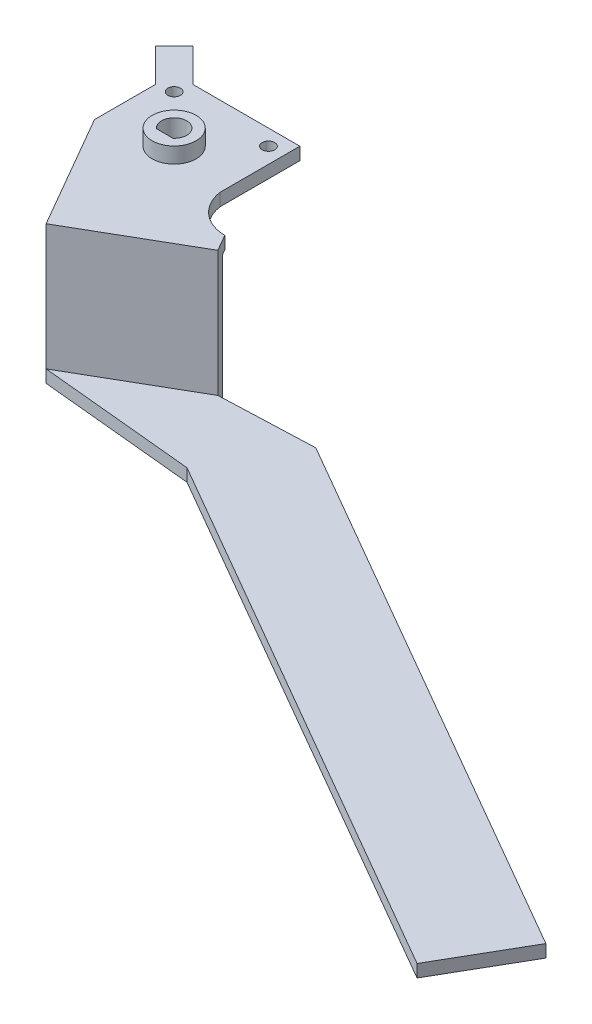
from build123d import *

# Parameters (mm, degrees)
SKETCH1_R           = 2
BOSS_EXTRUDE1_DEPTH = 4
SKETCH2_R           = 7
BOSS_EXTRUDE2_DEPTH = 5
BOSS_EXTRUDE6_DEPTH = 40
BOSS_EXTRUDE7_DEPTH = 4
SKETCH9_W           = 30
SKETCH9_H           = 4
BOSS_EXTRUDE8_DEPTH = 200


with BuildPart() as part:
    # Sketch1 → Boss-Extrude1 (new body)
    with BuildSketch(Plane(origin=(0, 0, 0), x_dir=(1, 0, 0), z_dir=(0, 1, 0))):
        with BuildLine():
            Line((1, -41.732050808), (35.641016151, -21.732050808))
            Line((35.641016151, -21.732050808), (32.641016151, -16.535898385))
            ThreePointArc((32.641016151, -16.535898385), (24.260749779, -13.277014078), (20, -5.358983849))
            Line((20, -5.358983849), (20, 20))
            Line((20, 20), (-14, 20))
            Line((-14, 20), (-24.606601718, 30.606601718))
            Line((-24.606601718, 30.606601718), (-30.606601718, 24.606601718))
            Line((-30.606601718, 24.606601718), (-20, 14))
            Line((-20, 14), (-20, -5.358983849))
            Line((-20, -5.358983849), (1, -41.732050808))
        make_face()
        with Locations(Location((-15, 15, 0), (0, 0, 270))):
            Circle(SKETCH1_R, mode=Mode.SUBTRACT)
        with Locations(Location((15, 15, 0), (0, 0, 270))):
            Circle(SKETCH1_R, mode=Mode.SUBTRACT)
        with BuildLine():
            Line((-2.645751311, -3), (2.645751311, -3))
            ThreePointArc((2.645751311, -3), (0, 4), (-2.645751311, -3))
        make_face(mode=Mode.SUBTRACT)
    extrude(amount=BOSS_EXTRUDE1_DEPTH)

    # Sketch2 → Boss-Extrude2 (add)
    with BuildSketch(Plane(origin=(0, 4, 0), x_dir=(1, 0, 0), z_dir=(0, 1, 0))):
        with Locations(Location((0, 0, 0), (0, 0, 270))):
            Circle(SKETCH2_R)
        with BuildLine():
            Line((-2.645751311, -3), (2.645751311, -3))
            ThreePointArc((2.645751311, -3), (0, 4), (-2.645751311, -3))
        make_face(mode=Mode.SUBTRACT)
    extrude(amount=BOSS_EXTRUDE2_DEPTH)

    # Sketch7 → Boss-Extrude6 (add)
    with BuildSketch(Plane.XZ):
        Polygon((1, 41.732050808), (35.641016151, 21.732050808), (33.641016151, 18.267949192), (-1, 38.267949192), align=None)
    extrude(amount=BOSS_EXTRUDE6_DEPTH)

    # Sketch8 → Boss-Extrude7 (add)
    with BuildSketch(Plane.XZ.offset(40)):
        Polygon((50.641016151, 46.558112383), (65.641016151, 20.577350269), (35.641016151, 21.732050808), (1, 41.732050808), align=None)
    extrude(amount=-BOSS_EXTRUDE7_DEPTH)

    # Sketch9 → Boss-Extrude8 (add)
    with BuildSketch(Plane(origin=(58.141016151, 0, 33.567731326), x_dir=(0.5000000000000051, 0, -0.8660254037844357), z_dir=(0.8660254037844357, 0, 0.5000000000000051))):
        with Locations((0, -38)):
            Rectangle(SKETCH9_W, SKETCH9_H)
    extrude(amount=BOSS_EXTRUDE8_DEPTH)


solid = part.part
